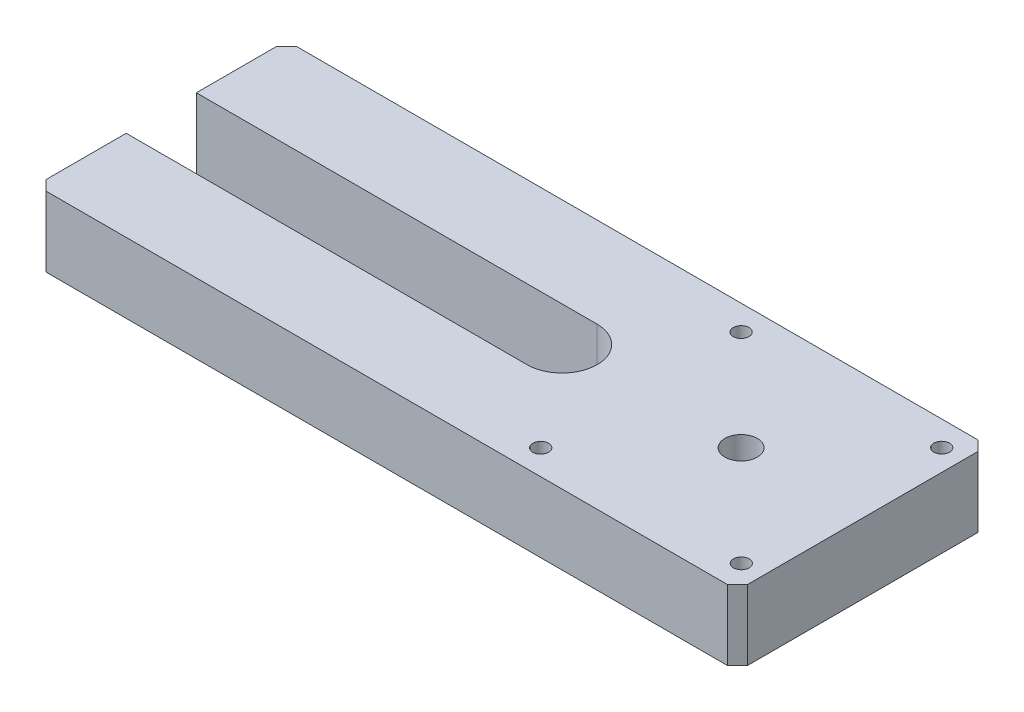
from build123d import *

# Parameters (mm, degrees)
SKETCH1_R           = 0.785
SKETCH1_R_2         = 1.62
BOSS_EXTRUDE1_DEPTH = 7
CUT_EXTRUDE1_DEPTH  = 7


with BuildPart() as part:
    # Sketch1 → Boss-Extrude1 (new body)
    with BuildSketch(Plane(origin=(0, 0, 0), x_dir=(1, 0, 0), z_dir=(0, 1, 0))):
        Polygon((0, 0), (68.005958877, 0), (69.002979439, 0.997020561), (69.002979439, 24.002979439), (68.005958877, 25), (0, 25), (-0.997020561, 24.002979439), (-0.997020561, 0.997020561), align=None)
        with Locations(Location((66.865958877, 2.520750677, 0), (0, 0, 270))):
            Circle(SKETCH1_R, mode=Mode.SUBTRACT)
        with Locations(Location((66.865958877, 22.520750677, 0), (0, 0, 270))):
            Circle(SKETCH1_R, mode=Mode.SUBTRACT)
        with Locations(Location((46.865958877, 22.5, 0), (0, 0, 270))):
            Circle(SKETCH1_R, mode=Mode.SUBTRACT)
        with Locations(Location((46.865958877, 2.5, 0), (0, 0, 270))):
            Circle(SKETCH1_R, mode=Mode.SUBTRACT)
        with Locations(Location((56.865958877, 12.5, 0), (0, 0, 270))):
            Circle(SKETCH1_R_2, mode=Mode.SUBTRACT)
    extrude(amount=BOSS_EXTRUDE1_DEPTH)

    # Sketch2 → Cut-Extrude1 (cut)
    with BuildSketch(Plane(origin=(0, 7, 0), x_dir=(1, 0, 0), z_dir=(0, 1, 0))):
        with BuildLine():
            Line((-0.997020561, 16), (39.002979439, 16))
            ThreePointArc((39.002979439, 16), (42.502979439, 12.5), (39.002979439, 9))
            Line((39.002979439, 9), (-0.997020561, 9))
            ThreePointArc((-0.997020561, 9), (-4.497020561, 12.5), (-0.997020561, 16))
        make_face()
    extrude(amount=-CUT_EXTRUDE1_DEPTH, mode=Mode.SUBTRACT)


solid = part.part
